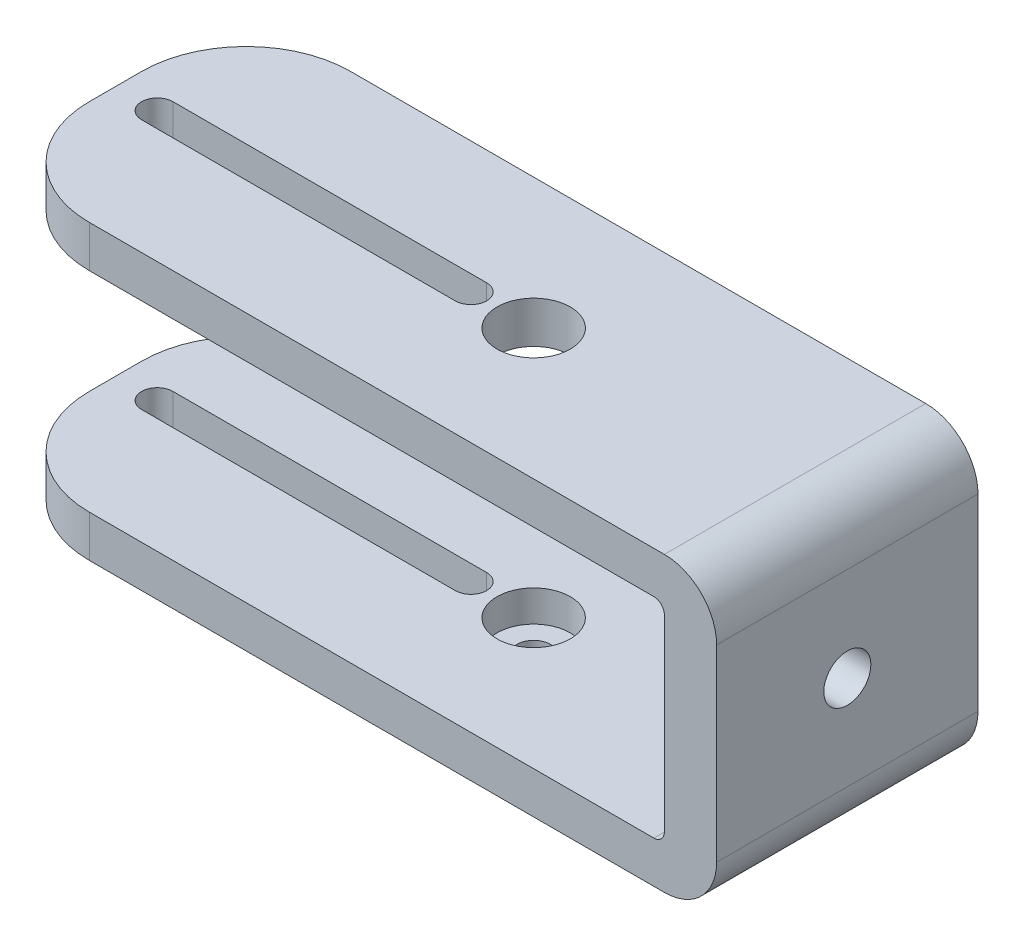
from build123d import *

# Parameters (mm, degrees)
SKETCH_1_W          = 70
SKETCH_1_H          = 25
EXTRUDE_1_DEPTH     = 4
SKETCH_2_W          = 5
SKETCH_2_H          = 25
EXTRUDE_2_DEPTH     = 20
SKETCH_3_W          = 70
SKETCH_3_H          = 25
EXTRUDE_3_DEPTH     = 4
SKETCH_4_R          = 1.6
CUT_EXTRUDE_1_DEPTH = 4
SKETCH_5_R          = 3.5
CUT_EXTRUDE_2_DEPTH = 3
SKETCH_6_R          = 3.5
CUT_EXTRUDE_3_DEPTH = 45.240818256
CUT_EXTRUDE_4_DEPTH = 47.532246883
FILLET_1_R          = 10
SKETCH_8_R          = 2.25
CUT_EXTRUDE_5_DEPTH = 77.42152838
FILLET_2_R          = 1
FILLET_3_R          = 5


with BuildPart() as part:
    # Эскиз1 → Бобышка-Вытянуть1 (new body)
    with BuildSketch(Plane(origin=(0, 0, 0), x_dir=(1, 0, 0), z_dir=(0, 1, 0))):
        Rectangle(SKETCH_1_W, SKETCH_1_H)
    extrude(amount=EXTRUDE_1_DEPTH)

    # Эскиз2 → Бобышка-Вытянуть2 (add)
    with BuildSketch(Plane(origin=(0, 4, 0), x_dir=(1, 0, 0), z_dir=(0, 1, 0))):
        with Locations((32.5, 0)):
            Rectangle(SKETCH_2_W, SKETCH_2_H)
    extrude(amount=EXTRUDE_2_DEPTH)

    # Эскиз3 → Бобышка-Вытянуть3 (add)
    with BuildSketch(Plane(origin=(0, 24, 0), x_dir=(1, 0, 0), z_dir=(0, 1, 0))):
        Rectangle(SKETCH_3_W, SKETCH_3_H)
    extrude(amount=EXTRUDE_3_DEPTH)

    # Эскиз4 → Вырез-Вытянуть1 (cut)
    with BuildSketch(Plane.XZ):
        with Locations(Location((5, 0, 0), (0, 0, 270))):
            Circle(SKETCH_4_R)
    extrude(amount=-CUT_EXTRUDE_1_DEPTH, mode=Mode.SUBTRACT)

    # Эскиз5 → Вырез-Вытянуть2 (cut)
    with BuildSketch(Plane(origin=(0, 4, 0), x_dir=(1, 0, 0), z_dir=(0, 1, 0))):
        with Locations(Location((5, 0, 0), (0, 0, 270))):
            Circle(SKETCH_5_R)
    extrude(amount=-CUT_EXTRUDE_2_DEPTH, mode=Mode.SUBTRACT)

    # Эскиз6 → Вырез-Вытянуть3 (cut, through all)
    with BuildSketch(Plane.XZ.offset(-24)):
        with Locations(Location((5, 0, 0), (0, 0, 90))):
            Circle(SKETCH_6_R)
    extrude(amount=-CUT_EXTRUDE_3_DEPTH, mode=Mode.SUBTRACT)

    # Эскиз7 → Вырез-Вытянуть4 (cut, through all)
    with BuildSketch(Plane(origin=(0, 28, 0), x_dir=(1, 0, 0), z_dir=(0, 1, 0))):
        with BuildLine():
            Line((-31, 1.5), (-1, 1.5))
            ThreePointArc((-1, 1.5), (0.5, 0), (-1, -1.5))
            Line((-1, -1.5), (-31, -1.5))
            ThreePointArc((-31, -1.5), (-32.5, 0), (-31, 1.5))
        make_face()
    extrude(amount=-CUT_EXTRUDE_4_DEPTH, mode=Mode.SUBTRACT)

    # Скругление1
    fillet_1_edges = [part.edges().sort_by_distance(p)[0] for p in [
        (-35, 26, -12.5),
        (-35, 26, 12.5),
        (-35, 2, 12.5),
        (-35, 2, -12.5),
    ]]
    fillet(fillet_1_edges, radius=FILLET_1_R)

    # Эскиз8 → Вырез-Вытянуть5 (cut, through all)
    with BuildSketch(Plane(origin=(35, 0, 0), x_dir=(0, 0, -1), z_dir=(1, 0, 0))):
        with Locations((0, 14)):
            Circle(SKETCH_8_R)
    extrude(amount=-CUT_EXTRUDE_5_DEPTH, mode=Mode.SUBTRACT)

    # Скругление2
    fillet_2_edges = [part.edges().sort_by_distance(p)[0] for p in [
        (30, 4, 0),
        (30, 24, 0),
    ]]
    fillet(fillet_2_edges, radius=FILLET_2_R)

    # Скругление3
    fillet_3_edges = [part.edges().sort_by_distance(p)[0] for p in [
        (35, 28, 0),
        (35, 0, 0),
    ]]
    fillet(fillet_3_edges, radius=FILLET_3_R)


solid = part.part
